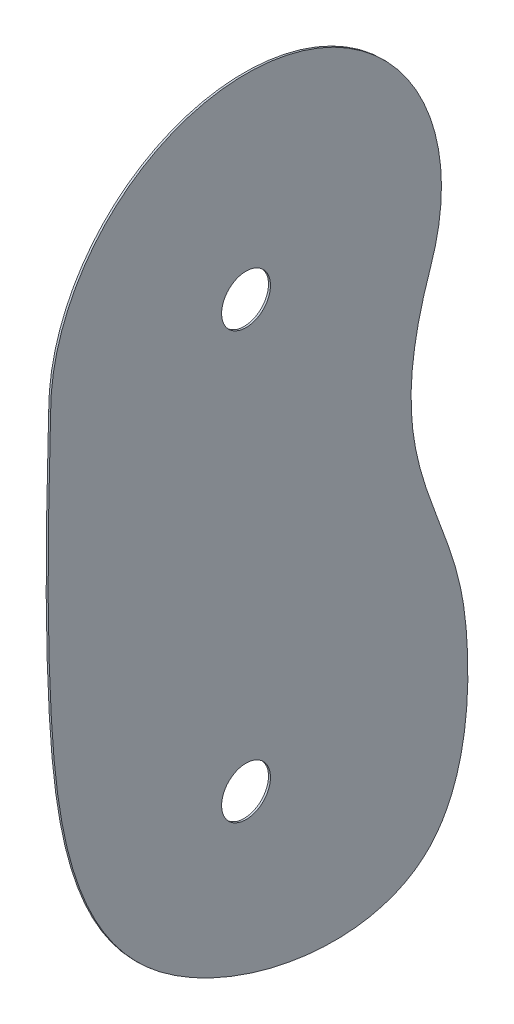
from build123d import *

# Parameters (mm, degrees)
SKETCH7_R      = 12.5
EXTRUDE1_DEPTH = 0.5


with BuildPart() as part:
    # Sketch7 → Extrude1 (new, symmetric)
    with BuildSketch(Plane(origin=(0, 0, 0), x_dir=(0, 0, -1), z_dir=(1, 0, 0))):
        with BuildLine():
            ThreePointArc((94.480455873, 185.280697489), (16.612561703, 316.654604329), (-100, 218.04414447))
            add(Edge.make_bspline(
                [(94.480455873, 185.280697489), (68.104894301, 109.221084996), (107.055453985, 75.966787725), (116.073780252, -17.867823054), (100.905342663, -110.410209261), (-83.819863838, -71.541743862), (-103.518734726, 85.315168335), (-101.111913872, 176.1020257), (-100, 218.04414447)],
                knots=[0, 0, 0, 0, 0.204089997, 0.240535662, 0.364456646, 0.573406233, 0.802920302, 1, 1, 1, 1], degree=3))
        make_face()
        with Locations((0, 218.04414447)):
            Circle(SKETCH7_R, mode=Mode.SUBTRACT)
        Circle(SKETCH7_R, mode=Mode.SUBTRACT)
    extrude(amount=EXTRUDE1_DEPTH, both=True)


solid = part.part
